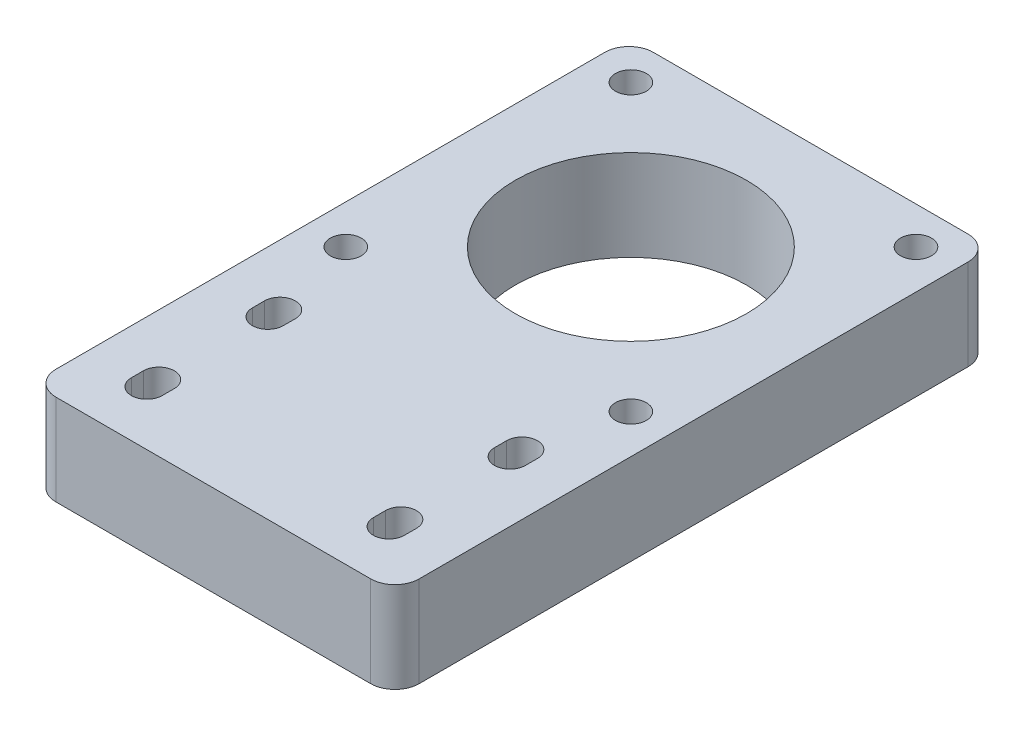
from build123d import *

# Parameters (mm, degrees)
SKETCH1_R           = 19.1
SKETCH1_R_2         = 2.55
BOSS_EXTRUDE1_DEPTH = 15


with BuildPart() as part:
    # Sketch1 → Boss-Extrude1 (new body)
    with BuildSketch(Plane(origin=(0, 0, 0), x_dir=(1, 0, 0), z_dir=(0, 1, 0))):
        with BuildLine():
            Line((-26, 29.7), (26, 29.7))
            ThreePointArc((26, 29.7), (28.828427125, 28.528427125), (30, 25.7))
            Line((30, 25.7), (30, -64.98))
            ThreePointArc((30, -64.98), (28.828427125, -67.808427125), (26, -68.98))
            Line((26, -68.98), (-26, -68.98))
            ThreePointArc((-26, -68.98), (-28.828427125, -67.808427125), (-30, -64.98))
            Line((-30, -64.98), (-30, 25.7))
            ThreePointArc((-30, 25.7), (-28.828427125, 28.528427125), (-26, 29.7))
        make_face()
        with Locations(Location((0, 0, 0), (0, 0, 270))):
            Circle(SKETCH1_R, mode=Mode.SUBTRACT)
        with Locations(Location((-23.55, 23.55, 0), (0, 0, 270))):
            Circle(SKETCH1_R_2, mode=Mode.SUBTRACT)
        with Locations(Location((23.55, 23.55, 0), (0, 0, 90))):
            Circle(SKETCH1_R_2, mode=Mode.SUBTRACT)
        with Locations(Location((23.55, -23.55, 0), (0, 0, 270))):
            Circle(SKETCH1_R_2, mode=Mode.SUBTRACT)
        with Locations(Location((-23.55, -23.55, 0), (0, 0, 90))):
            Circle(SKETCH1_R_2, mode=Mode.SUBTRACT)
        with BuildLine():
            Line((-22.55, -37.98), (-22.55, -39.98))
            ThreePointArc((-22.55, -39.98), (-20, -42.53), (-17.45, -39.98))
            Line((-17.45, -39.98), (-17.45, -37.98))
            ThreePointArc((-17.45, -37.98), (-20, -35.43), (-22.55, -37.98))
        make_face(mode=Mode.SUBTRACT)
        with BuildLine():
            Line((-22.55, -59.98), (-22.55, -57.98))
            ThreePointArc((-22.55, -57.98), (-20, -55.43), (-17.45, -57.98))
            Line((-17.45, -57.98), (-17.45, -59.98))
            ThreePointArc((-17.45, -59.98), (-20, -62.53), (-22.55, -59.98))
        make_face(mode=Mode.SUBTRACT)
        with BuildLine():
            Line((17.45, -37.98), (17.45, -39.98))
            ThreePointArc((17.45, -39.98), (20, -42.53), (22.55, -39.98))
            Line((22.55, -39.98), (22.55, -37.98))
            ThreePointArc((22.55, -37.98), (20, -35.43), (17.45, -37.98))
        make_face(mode=Mode.SUBTRACT)
        with BuildLine():
            Line((22.55, -59.98), (22.55, -57.98))
            ThreePointArc((22.55, -57.98), (20, -55.43), (17.45, -57.98))
            Line((17.45, -57.98), (17.45, -59.98))
            ThreePointArc((17.45, -59.98), (20, -62.53), (22.55, -59.98))
        make_face(mode=Mode.SUBTRACT)
    extrude(amount=BOSS_EXTRUDE1_DEPTH)


solid = part.part
